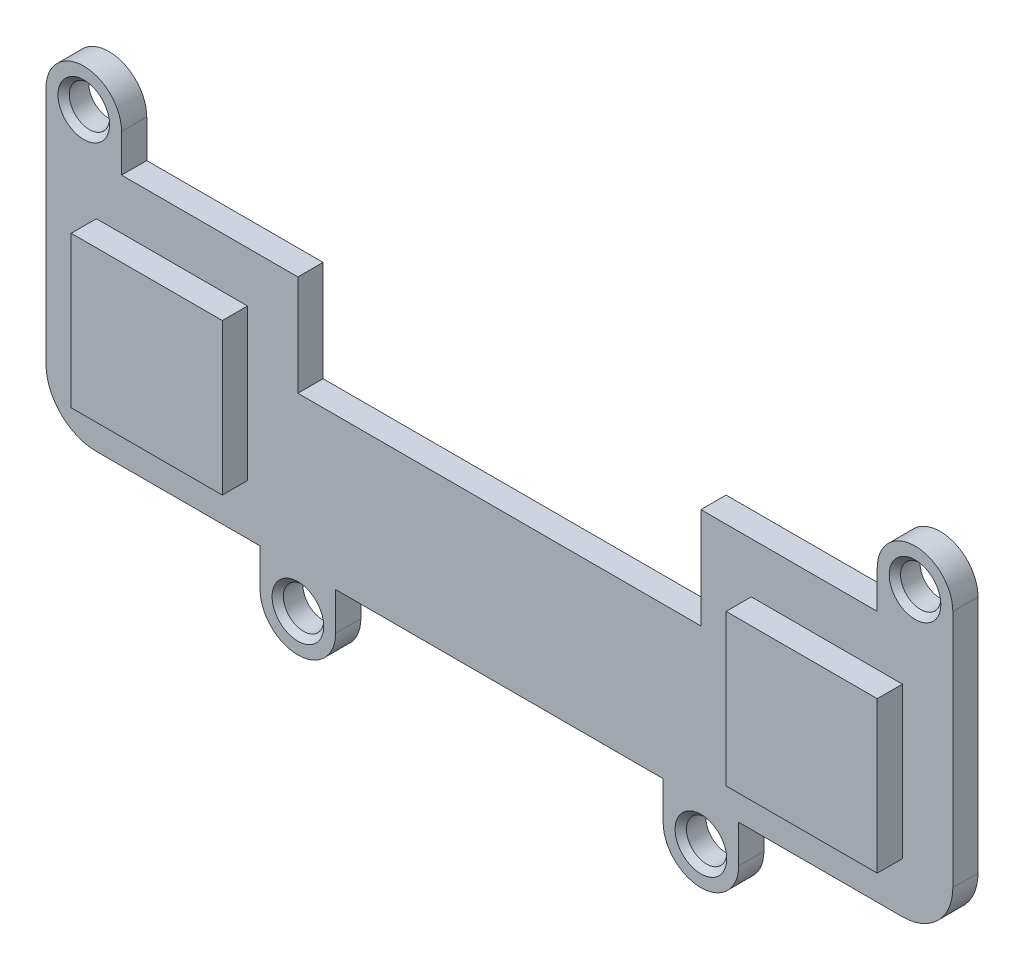
from build123d import *

# Parameters (mm, degrees)
EXTRUDE_1_DEPTH             = 1
SKETCH_2_W                  = 6
SKETCH_2_H                  = 6
EXTRUDE_2_DEPTH             = 1
SKETCH_3_W                  = 20
SKETCH_3_H                  = 1
EXTRUDE_3_DEPTH             = 1.5
FILLET_1_R                  = 2
HOLE_WIZARD_M2_1_AT_2_COUNT = 2
HOLE_WIZARD_M2_1_AT_2_PITCH = 15.532224567
HOLE_WIZARD_M2_1_AT_3_COUNT = 2
HOLE_WIZARD_M2_1_AT_3_PITCH = 27.735356497
HOLE_WIZARD_M2_1_AT_4_COUNT = 2
HOLE_WIZARD_M2_1_AT_4_PITCH = 33
CUT_EXTRUDE_1_DEPTH         = 37.932370625


with BuildPart() as part:
    # 草图1 → 凸台-拉伸1 (new body)
    with BuildSketch(Plane.XY):
        Polygon((-8, 5), (-15, 5), (-16.499999995, 5), (-18, 5), (-18, -5), (-9.5, -5), (-8.000000003, -5), (-6.5, -5), (6.5, -5), (8, -5), (9.5, -5), (18, -5), (18, 5), (16.500000001, 5), (15, 5), (8, 5), (8, 1), (-8, 1), align=None)
        with BuildLine():
            ThreePointArc((-6.5, -6.5), (-6.939339829, -5.439339827), (-8.000000003, -5))
            ThreePointArc((-8.000000003, -5), (-9.060660173, -5.439339829), (-9.5, -6.5))
            Line((-9.5, -6.5), (-6.5, -6.5))
        make_face()
        with BuildLine():
            Line((-6.5, -6.5), (-9.5, -6.5))
            ThreePointArc((-9.5, -6.5), (-8, -8), (-6.5, -6.5))
        make_face()
        with BuildLine():
            Line((-8.000000003, -5), (-9.5, -5))
            Line((-9.5, -5), (-9.5, -6.5))
            ThreePointArc((-9.5, -6.5), (-9.060660173, -5.439339829), (-8.000000003, -5))
        make_face()
        with BuildLine():
            Line((-6.5, -5), (-8.000000003, -5))
            ThreePointArc((-8.000000003, -5), (-6.939339829, -5.439339827), (-6.5, -6.5))
            Line((-6.5, -6.5), (-6.5, -5))
        make_face()
        with BuildLine():
            ThreePointArc((9.5, -6.5), (9.060660172, -5.439339828), (8, -5))
            ThreePointArc((8, -5), (6.939339828, -5.439339828), (6.5, -6.5))
            Line((6.5, -6.5), (9.5, -6.5))
        make_face()
        with BuildLine():
            ThreePointArc((6.5, -6.5), (8, -8), (9.5, -6.5))
            Line((9.5, -6.5), (6.5, -6.5))
        make_face()
        with BuildLine():
            Line((8, -5), (6.5, -5))
            Line((6.5, -5), (6.5, -6.5))
            ThreePointArc((6.5, -6.5), (6.939339828, -5.439339828), (8, -5))
        make_face()
        with BuildLine():
            Line((9.5, -6.5), (9.5, -5))
            Line((9.5, -5), (8, -5))
            ThreePointArc((8, -5), (9.060660172, -5.439339828), (9.5, -6.5))
        make_face()
        with BuildLine():
            Line((-18, 5), (-16.499999995, 5))
            ThreePointArc((-16.499999995, 5), (-17.56066017, 5.439339826), (-18, 6.5))
            Line((-18, 6.5), (-18, 5))
        make_face()
        with BuildLine():
            ThreePointArc((-18, 6.5), (-17.56066017, 5.439339826), (-16.499999995, 5))
            ThreePointArc((-16.499999995, 5), (-15.439339826, 5.43933983), (-15, 6.5))
            Line((-15, 6.5), (-18, 6.5))
        make_face()
        with BuildLine():
            Line((-18, 6.5), (-15, 6.5))
            ThreePointArc((-15, 6.5), (-16.5, 8), (-18, 6.5))
        make_face()
        with BuildLine():
            Line((-16.499999995, 5), (-15, 5))
            Line((-15, 5), (-15, 6.5))
            ThreePointArc((-15, 6.5), (-15.439339826, 5.43933983), (-16.499999995, 5))
        make_face()
        with BuildLine():
            Line((15, 6.5), (15, 5))
            Line((15, 5), (16.500000001, 5))
            ThreePointArc((16.500000001, 5), (15.439339829, 5.439339828), (15, 6.5))
        make_face()
        with BuildLine():
            ThreePointArc((15, 6.5), (15.439339829, 5.439339828), (16.500000001, 5))
            ThreePointArc((16.500000001, 5), (17.560660172, 5.439339829), (18, 6.5))
            Line((18, 6.5), (15, 6.5))
        make_face()
        with BuildLine():
            ThreePointArc((18, 6.5), (16.5, 8), (15, 6.5))
            Line((15, 6.5), (18, 6.5))
        make_face()
        with BuildLine():
            ThreePointArc((18, 6.5), (17.560660172, 5.439339829), (16.500000001, 5))
            Line((16.500000001, 5), (18, 5))
            Line((18, 5), (18, 6.5))
        make_face()
    extrude(amount=EXTRUDE_1_DEPTH)

    # 草图2 → 凸台-拉伸2 (add)
    with BuildSketch(Plane.XY.offset(1)):
        with Locations((-13, 0)):
            Rectangle(SKETCH_2_W, SKETCH_2_H)
        with Locations((13, 0)):
            Rectangle(SKETCH_2_W, SKETCH_2_H)
    extrude(amount=EXTRUDE_2_DEPTH)

    # 草图3 → 凸台-拉伸3 (add)
    with BuildSketch(Plane(origin=(0, 0, 0), x_dir=(-1, 0, 0), z_dir=(0, 0, -1))):
        with Locations((2, 0.5)):
            Rectangle(SKETCH_3_W, SKETCH_3_H)
    extrude(amount=EXTRUDE_3_DEPTH)

    # 圆角1
    fillet_1_edges = [part.edges().sort_by_distance(p)[0] for p in [
        (18, -5, 0.5),
        (-18, -5, 0.5),
    ]]
    fillet(fillet_1_edges, radius=FILLET_1_R)

    # 草图5 → M2 螺纹孔1 (revolve, cut)
    with BuildSketch(Plane(origin=(-16.5, 6.5, 1), x_dir=(0, -1, 0), z_dir=(1, 0, 0))):
        Polygon((0, 0), (0, 1), (0.8, 1), (0.8, 0.225), (1.025, 0), align=None)
    hole_wizard_m2_1 = revolve(axis=Axis((-16.5, 6.5, 7.35), (0, 0, -1)), mode=Mode.SUBTRACT)

    # M2 螺纹孔1 at 2: M2 螺纹孔1 ×2
    with Locations(*[Vector(0.5472493629827028, -0.8369696139735456, 0) * (i * HOLE_WIZARD_M2_1_AT_2_PITCH) for i in range(1, HOLE_WIZARD_M2_1_AT_2_COUNT)]):
        add(hole_wizard_m2_1, mode=Mode.SUBTRACT)

    # M2 螺纹孔1 at 3: M2 螺纹孔1 ×2
    with Locations(*[Vector(0.8833490206949295, -0.46871580689935033, 0) * (i * HOLE_WIZARD_M2_1_AT_3_PITCH) for i in range(1, HOLE_WIZARD_M2_1_AT_3_COUNT)]):
        add(hole_wizard_m2_1, mode=Mode.SUBTRACT)

    # M2 螺纹孔1 at 4: M2 螺纹孔1 ×2
    with Locations(*[(i * HOLE_WIZARD_M2_1_AT_4_PITCH, 0, 0) for i in range(1, HOLE_WIZARD_M2_1_AT_4_COUNT)]):
        add(hole_wizard_m2_1, mode=Mode.SUBTRACT)

    # 草图7 → 切除-拉伸1 (cut, through all)
    with BuildSketch(Plane.ZY.offset(18)):
        Polygon((0, 52.66451622), (0, 8.533671193), (0, -8.947821263), (0, -53.078666291), (-88.261690055, -53.078666291), (-88.261690055, 52.66451622), align=None)
    extrude(amount=-CUT_EXTRUDE_1_DEPTH, mode=Mode.SUBTRACT)


solid = part.part
